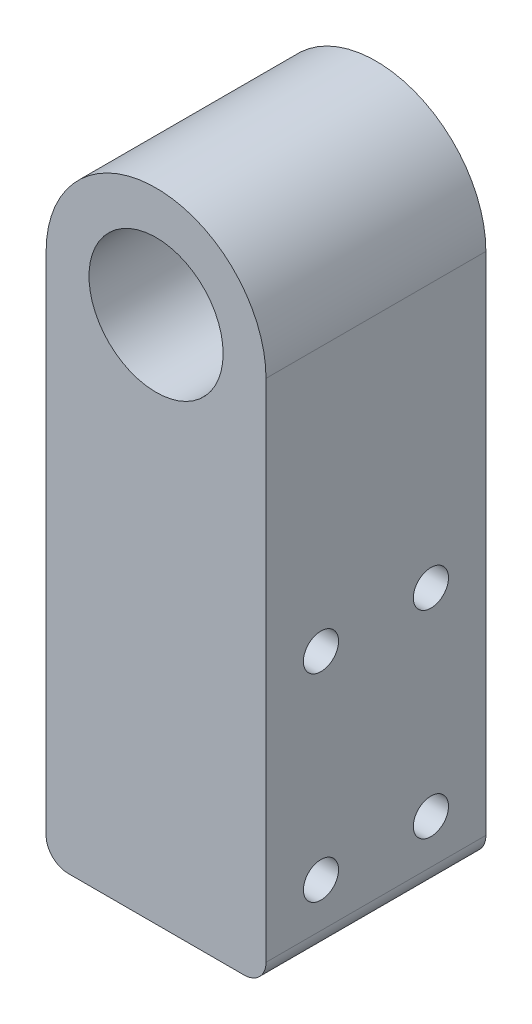
from build123d import *

# Parameters (mm, degrees)
SKETCH_1_R          = 6.1
EXTRUDE_1_DEPTH     = 20
SKETCH_2_R          = 1.6
CUT_EXTRUDE_1_DEPTH = 65.52906322
FILLET_1_R          = 2


with BuildPart() as part:
    # 草图1 → 凸台-拉伸1 (new body)
    with BuildSketch(Plane.XY):
        with BuildLine():
            Line((0, 0), (20, 0))
            Line((20, 0), (20, 30))
            Line((20, 30), (20, 48))
            ThreePointArc((20, 48), (10, 58), (0, 48))
            Line((0, 48), (0, 30))
            Line((0, 30), (0, 0))
        make_face()
        with Locations((10, 48)):
            Circle(SKETCH_1_R, mode=Mode.SUBTRACT)
    extrude(amount=EXTRUDE_1_DEPTH)

    # 草图2 → 切除-拉伸1 (cut, through all)
    with BuildSketch(Plane(origin=(20, 0, 0), x_dir=(0, 0, -1), z_dir=(1, 0, 0))):
        with Locations((-15, 24)):
            Circle(SKETCH_2_R)
        with Locations(Location((-15, 6, 0), (0, 0, 180))):
            Circle(SKETCH_2_R)
        with Locations((-5, 6)):
            Circle(SKETCH_2_R)
        with Locations(Location((-5, 24, 0), (0, 0, 180))):
            Circle(SKETCH_2_R)
    extrude(amount=-CUT_EXTRUDE_1_DEPTH, mode=Mode.SUBTRACT)

    # 圆角1
    fillet_1_edges = [part.edges().sort_by_distance(p)[0] for p in [
        (20, 0, 10),
        (0, 0, 10),
    ]]
    fillet(fillet_1_edges, radius=FILLET_1_R)


solid = part.part
